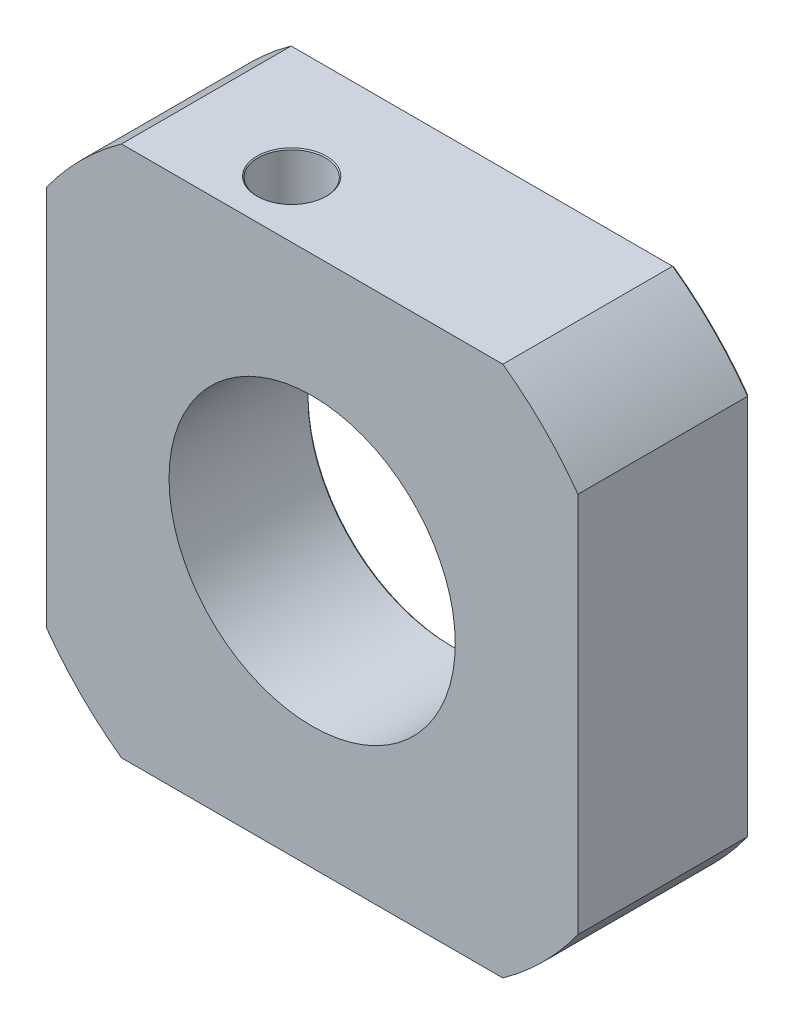
from build123d import *

# Parameters (mm, degrees)
BOSS_EXTRUDE1_DEPTH                      = 42
CBORE_FOR_M64_HEX_HEAD_BOLT1_D           = 70
CBORE_FOR_M64_HEX_HEAD_BOLT1_CBORE_D     = 110
CBORE_FOR_M64_HEX_HEAD_BOLT1_CBORE_DEPTH = 7.5
F_16_5_16_5_DIAMETER_HOLE1_REACH         = 188.325
F_16_5_16_5_DIAMETER_HOLE1_BORE_R        = 8.25
M6_CLEARANCE_HOLE1_D                     = 6.647
M6_CLEARANCE_HOLE1_DEPTH                 = 22.2
M6_CLEARANCE_HOLE1_TIP                   = 1.996960267
CHAMFER1_SIZE                            = 0.5
CHAMFER2_SIZE                            = 1.1765
CHAMFER3_SIZE                            = 0.25


with BuildPart() as part:
    # Sketch1 → Boss-Extrude1 (new body)
    with BuildSketch(Plane(origin=(0, 0, -111.250000238), x_dir=(-1, 0, 0), z_dir=(0, 0, -1))):
        with BuildLine():
            Line((-55.395346272, -72.559925727), (37.878444259, -72.559925727))
            ThreePointArc((37.878444259, -72.559925727), (47.810091488, -64.128468222), (56.241548993, -54.196820993))
            Line((56.241548993, -54.196820993), (56.241548993, 39.076969538))
            ThreePointArc((56.241548993, 39.076969538), (47.810091488, 49.008616768), (37.878444259, 57.440074273))
            Line((37.878444259, 57.440074273), (-55.395346272, 57.440074273))
            ThreePointArc((-55.395346272, 57.440074273), (-65.326993501, 49.008616768), (-73.758451007, 39.076969538))
            Line((-73.758451007, 39.076969538), (-73.758451007, -54.196820993))
            ThreePointArc((-73.758451007, -54.196820993), (-65.326993501, -64.128468222), (-55.395346272, -72.559925727))
        make_face()
    extrude(amount=-BOSS_EXTRUDE1_DEPTH)

    # CBORE for M64 Hex Head Bolt1 (through all)
    with Locations(Plane(origin=(0, 0, -111.250000238), x_dir=(-1, 0, 0), z_dir=(0, 0, -1))):
        with Locations((-8.758451007, -7.559925727)):
            CounterBoreHole(CBORE_FOR_M64_HEX_HEAD_BOLT1_D / 2, CBORE_FOR_M64_HEX_HEAD_BOLT1_CBORE_D / 2, CBORE_FOR_M64_HEX_HEAD_BOLT1_CBORE_DEPTH)

    # Ø16.5 (16.5) Diameter Hole1 bore → Ø16.5 (16.5) Diameter Hole1 (cut, up to next)
    with BuildSketch(Plane(origin=(0, 57.440074273, 0), x_dir=(1, 0, 0), z_dir=(0, 1, 0)), mode=Mode.PRIVATE) as f_16_5_16_5_diameter_hole1_sk1:
        with Locations((-10.241548993, 83.250000238)):
            Circle(F_16_5_16_5_DIAMETER_HOLE1_BORE_R)
    f_16_5_16_5_diameter_hole1_tool1 = extrude(f_16_5_16_5_diameter_hole1_sk1.sketch, amount=-F_16_5_16_5_DIAMETER_HOLE1_REACH, mode=Mode.PRIVATE) & part.part
    add(f_16_5_16_5_diameter_hole1_tool1.solids().sort_by_distance((-10.241549, 57.440074, -83.25))[0], mode=Mode.SUBTRACT)

    # M6 Clearance Hole1
    with Locations(Plane(origin=(0, 0, -111.250000238), x_dir=(-1, 0, 0), z_dir=(0, 0, -1))):
        with Locations((42.506790629, -58.825167363), (-60.023692643, -58.825167363), (-60.023692643, 43.705315909), (42.506790629, 43.705315909)):
            Hole(M6_CLEARANCE_HOLE1_D / 2, depth=M6_CLEARANCE_HOLE1_DEPTH)
            with Locations((0, 0, -(M6_CLEARANCE_HOLE1_DEPTH + M6_CLEARANCE_HOLE1_TIP / 2))):  # 118° drill point
                Cone(0, M6_CLEARANCE_HOLE1_D / 2, M6_CLEARANCE_HOLE1_TIP, mode=Mode.SUBTRACT)

    # Chamfer1
    chamfer1_edges = [part.edges().sort_by_distance(p)[0] for p in [
        (-56.241548993, -7.559925727, -111.250000238),
        (-47.810091488, -64.128468222, -111.250000238),
        (8.758451007, -72.559925727, -111.250000238),
        (65.326993501, -64.128468222, -111.250000238),
        (63.758451007, -7.559925727, -111.250000238),
        (-26.241548993, -7.559925727, -103.750000238),
        (73.758451007, -7.559925727, -111.250000238),
        (65.326993501, 49.008616768, -111.250000238),
        (8.758451007, 57.440074273, -111.250000238),
        (-47.810091488, 49.008616768, -111.250000238),
    ]]
    chamfer(chamfer1_edges, length=CHAMFER1_SIZE)

    # Chamfer2
    chamfer2_edges = [part.edges().sort_by_distance(p)[0] for p in [
        (-45.830290629, 43.705315909, -111.250000238),
        (56.700192643, 43.705315909, -111.250000238),
        (56.700192643, -58.825167363, -111.250000238),
        (-45.830290629, -58.825167363, -111.250000238),
    ]]
    chamfer(chamfer2_edges, length=CHAMFER2_SIZE)

    # Chamfer3
    chamfer3_edges = [part.edges().sort_by_distance(p)[0] for p in [
        (-18.491548993, 57.440074273, -83.250000238),
    ]]
    chamfer(chamfer3_edges, length=CHAMFER3_SIZE)


solid = part.part
